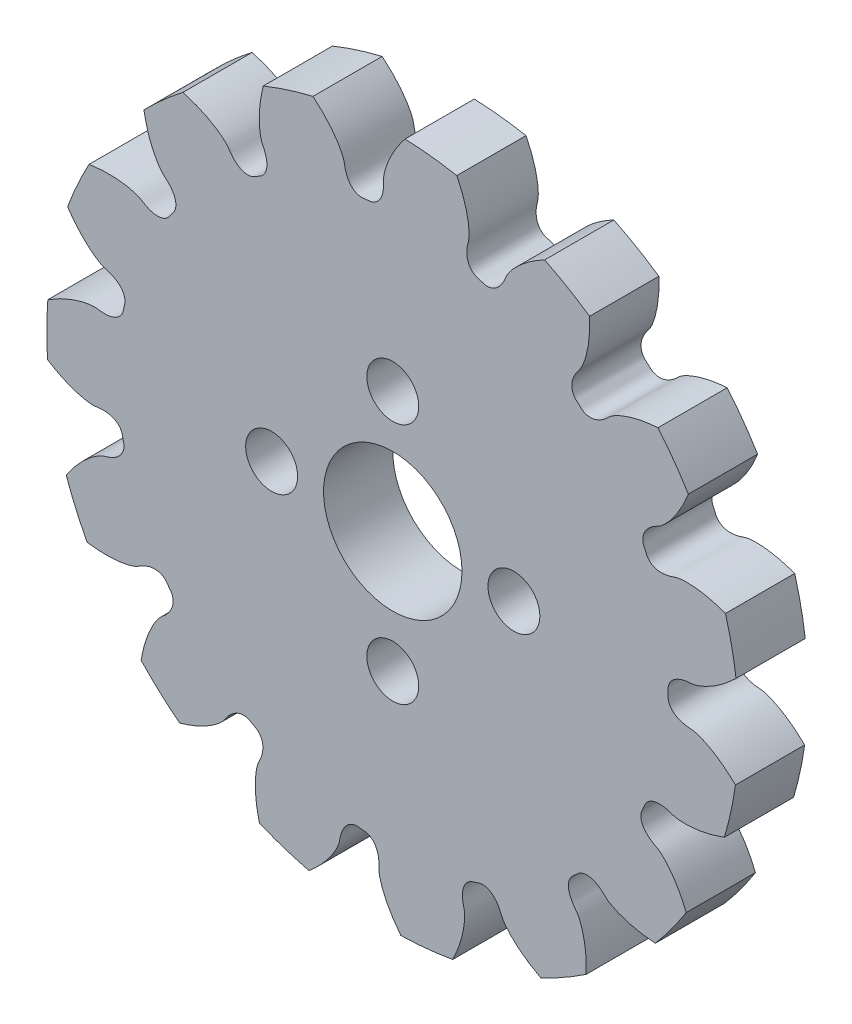
from build123d import *

# Parameters (mm, degrees)
SKETCHREVOLVESPURPINION_W       = 4
SKETCHREVOLVESPURPINION_H       = 20
TOOTHEXTRUDECUTSPURPINION_DEPTH = 5
SKETCH_6_R                      = 1.5
SKETCH_6_R_2                    = 4
CUT_EXTRUDE_3_DEPTH             = 29.565713868
PATTERN_CIRCULAR_1_COUNT        = 15


with BuildPart() as part:
    # SketchRevolveSpurPinion → SpurPinion (revolve)
    with BuildSketch(Plane(origin=(0, 0, 0), x_dir=(0, 0, -1), z_dir=(1, 0, 0))):
        with Locations((-3, 10)):
            Rectangle(SKETCHREVOLVESPURPINION_W, SKETCHREVOLVESPURPINION_H)
    revolve(axis=Axis((0, 0, 0), (0, 0, -1)))

    # SketchToothSpurPinion → ToothExtrudeCutSpurPinion (cut, symmetric)
    with BuildSketch(Plane.XY):
        with BuildLine():
            ThreePointArc((19.842307364, 2.559485125), (20.078446913, -0.135152004), (19.842307364, -2.829789133))
            add(Edge.make_bspline(
                [(19.842307364, -2.829789133), (19.706231936, -2.696081388), (19.501123969, -2.507222284), (19.222594436, -2.276731472), (19.025781808, -2.124932462), (18.836114558, -1.988759078), (18.654419174, -1.867531545), (18.481483552, -1.760531957), (18.31805537, -1.667006365), (18.164840499, -1.586167309), (18.022501825, -1.517193486), (17.891657027, -1.459239433), (17.772880137, -1.411413127), (17.666691466, -1.372855396), (17.573584004, -1.342503752), (17.493939972, -1.319810308), (17.32426838, -1.275533234), (17.158483196, -1.277352682), (17.003068763, -1.256845194), (16.956065863, -1.249880876), (16.909847403, -1.242031196), (16.864392992, -1.233349702), (16.819696613, -1.223814543), (16.775747096, -1.213420037), (16.732533305, -1.202152101), (16.690042874, -1.189994124), (16.648262711, -1.176924761), (16.607179113, -1.162917773), (16.566778105, -1.147941231), (16.527045852, -1.131956802), (16.487969253, -1.11491893), (16.44953672, -1.09677396), (16.411739218, -1.07745923), (16.374571619, -1.05690216), (16.338034451, -1.035019394), (16.302136115, -1.011716093), (16.266895668, -0.986885501), (16.232346239, -0.960408968), (16.198539134, -0.93215669), (16.165548638, -0.901989467), (16.13347741, -0.869761915), (16.102462237, -0.835327553), (16.072679697, -0.798546285), (16.044350984, -0.759294642), (16.017744841, -0.717479003), (15.993177311, -0.67305154), (15.971006402, -0.626028029), (15.951621801, -0.576505634), (15.935422745, -0.524678703), (15.92280774, -0.47084656), (15.914088189, -0.415420391), (15.910062171, -0.363875667), (15.908462674, -0.270346226), (15.912782909, -0.135152004), (15.908462674, 4.2217e-05), (15.910062171, 0.093571658), (15.914088189, 0.145116383), (15.92280774, 0.200542551), (15.935422745, 0.254374694), (15.951621801, 0.306201625), (15.971006402, 0.35572402), (15.993177311, 0.402747531), (16.017744841, 0.447174995), (16.044350984, 0.488990633), (16.072679697, 0.528242276), (16.102462237, 0.565023545), (16.13347741, 0.599457906), (16.165548638, 0.631685458), (16.198539134, 0.661852681), (16.232346239, 0.69010496), (16.266895668, 0.716581492), (16.302136115, 0.741412085), (16.338034451, 0.764715386), (16.374571619, 0.786598151), (16.411739218, 0.807155221), (16.44953672, 0.826469951), (16.487969253, 0.844614921), (16.527045852, 0.861652793), (16.566778105, 0.877637222), (16.607179113, 0.892613765), (16.648262711, 0.906620753), (16.690042874, 0.919690115), (16.732533305, 0.931848092), (16.775747096, 0.943116028), (16.819696613, 0.953510534), (16.864392992, 0.963045693), (16.909847403, 0.971727187), (16.956065863, 0.979576867), (17.003068763, 0.986541186), (17.158483196, 1.007048674), (17.32426838, 1.005229226), (17.493939972, 1.049506299), (17.573584004, 1.072199744), (17.666691466, 1.102551388), (17.772880137, 1.141109118), (17.891657027, 1.188935424), (18.022501825, 1.246889477), (18.164840499, 1.3158633), (18.31805537, 1.396702356), (18.481483552, 1.490227948), (18.654419174, 1.597227536), (18.836114558, 1.718455069), (19.025781808, 1.854628454), (19.222594436, 2.006427463), (19.501123969, 2.236918275), (19.706231936, 2.425777379), (19.842307364, 2.559485125)],
                knots=[0, 0, 0, 0, 0.056360502, 0.082315996, 0.106788319, 0.129777471, 0.151283452, 0.171306262, 0.189845901, 0.206902369, 0.222475666, 0.236565792, 0.249172746, 0.26029653, 0.269937143, 0.278094585, 0.284768856, 0.321669005, 0.326411926, 0.331089867, 0.335705376, 0.340261234, 0.34476047, 0.349206393, 0.353602615, 0.357953089, 0.362262134, 0.366534478, 0.370775293, 0.374990234, 0.379185482, 0.383367787, 0.387544497, 0.391723599, 0.395913739, 0.400124226, 0.404365023, 0.408646691, 0.412980305, 0.417377296, 0.421849222, 0.426407451, 0.431062723, 0.435824606, 0.440700822, 0.44569649, 0.450813317, 0.456048827, 0.461395741, 0.466841642, 0.472369055, 0.477956022, 0.482100342, 0.5, 0.517899658, 0.522043978, 0.527630945, 0.533158358, 0.538604259, 0.543951173, 0.549186683, 0.55430351, 0.559299178, 0.564175394, 0.568937277, 0.573592549, 0.578150778, 0.582622704, 0.587019695, 0.591353309, 0.595634977, 0.599875774, 0.604086261, 0.608276401, 0.612455503, 0.616632213, 0.620814518, 0.625009766, 0.629224707, 0.633465522, 0.637737866, 0.642046911, 0.646397385, 0.650793607, 0.65523953, 0.659738766, 0.664294624, 0.668910133, 0.673588074, 0.678330995, 0.715231144, 0.721905415, 0.730062857, 0.73970347, 0.750827254, 0.763434208, 0.777524334, 0.793097631, 0.810154099, 0.828693738, 0.848716548, 0.870222529, 0.893211681, 0.917684004, 0.943639498, 1, 1, 1, 1], degree=3))
        make_face()
    toothextrudecutspurpinion = extrude(amount=TOOTHEXTRUDECUTSPURPINION_DEPTH, both=True, mode=Mode.SUBTRACT)

    # Эскиз6 → Вырез-Вытянуть3 (cut, through all)
    with BuildSketch(Plane.XY.offset(5)):
        with Locations((0, 7)):
            Circle(SKETCH_6_R)
        with Locations((7, 0)):
            Circle(SKETCH_6_R)
        with Locations((0, -7)):
            Circle(SKETCH_6_R)
        with Locations((-7, 0)):
            Circle(SKETCH_6_R)
        Circle(SKETCH_6_R_2)
    extrude(amount=-CUT_EXTRUDE_3_DEPTH, mode=Mode.SUBTRACT)

    # Круговой массив1: ToothExtrudeCutSpurPinion ×15 about axis
    pattern_circular_1_axis = Axis((0, 0, 5), (0, 0, 1))
    for i in range(1, PATTERN_CIRCULAR_1_COUNT):
        add(toothextrudecutspurpinion.rotate(pattern_circular_1_axis, i * 360 / PATTERN_CIRCULAR_1_COUNT), mode=Mode.SUBTRACT)


solid = part.part
